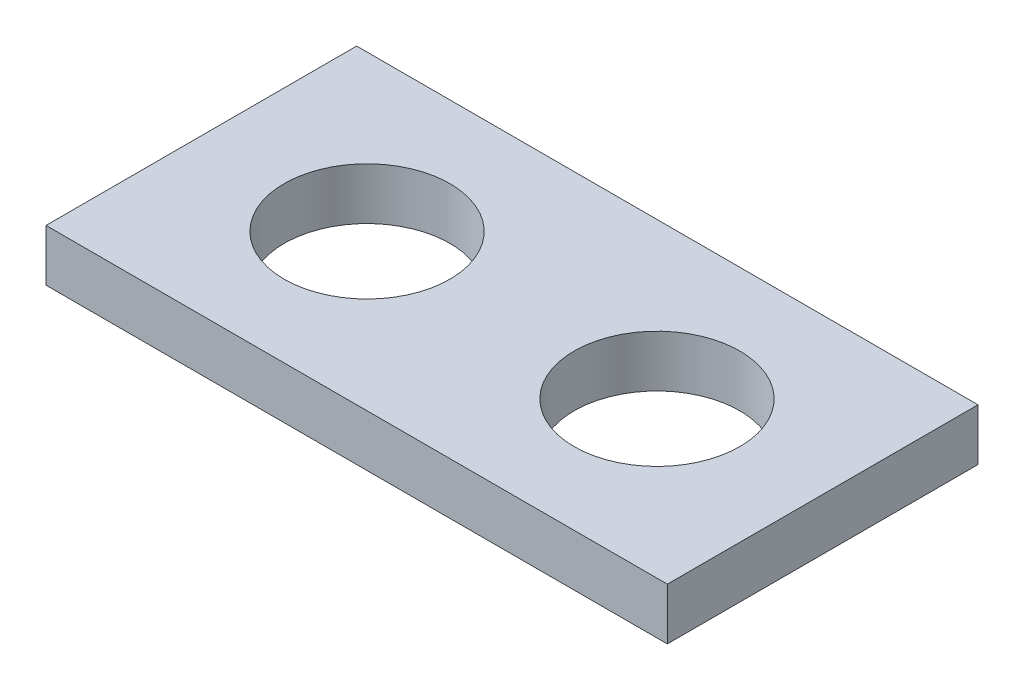
from build123d import *

# Parameters (mm, degrees)
SKETCH2_W               = 30
SKETCH2_H               = 15
BOSS_EXTRUDE1_DEPTH     = 2.5
CUT_EXTRUDE1_DEPTH      = 34.634060118
CUT_EXTRUDE1_DEPTH_BACK = 34.634060118
SKETCH4_R               = 4


with BuildPart() as part:
    # Sketch2 → Boss-Extrude1 (new body)
    with BuildSketch(Plane(origin=(0, 0, 0), x_dir=(1, 0, 0), z_dir=(0, 1, 0))):
        with Locations((15, 7.5)):
            Rectangle(SKETCH2_W, SKETCH2_H)
    extrude(amount=BOSS_EXTRUDE1_DEPTH)

    # Sketch4 → Cut-Extrude1 (cut, two sides: drawn at the far end of the back side and taken through both)
    with BuildSketch(Plane(origin=(0, 2.5, 0), x_dir=(1, 0, 0), z_dir=(0, 1, 0)).offset(-CUT_EXTRUDE1_DEPTH_BACK)):
        with Locations(Location((22, 7.5, 0), (0, 0, 270))):
            Circle(SKETCH4_R)
        with Locations(Location((8, 7.5, 0), (0, 0, 270))):
            Circle(SKETCH4_R)
    extrude(amount=CUT_EXTRUDE1_DEPTH + CUT_EXTRUDE1_DEPTH_BACK, mode=Mode.SUBTRACT)


solid = part.part
